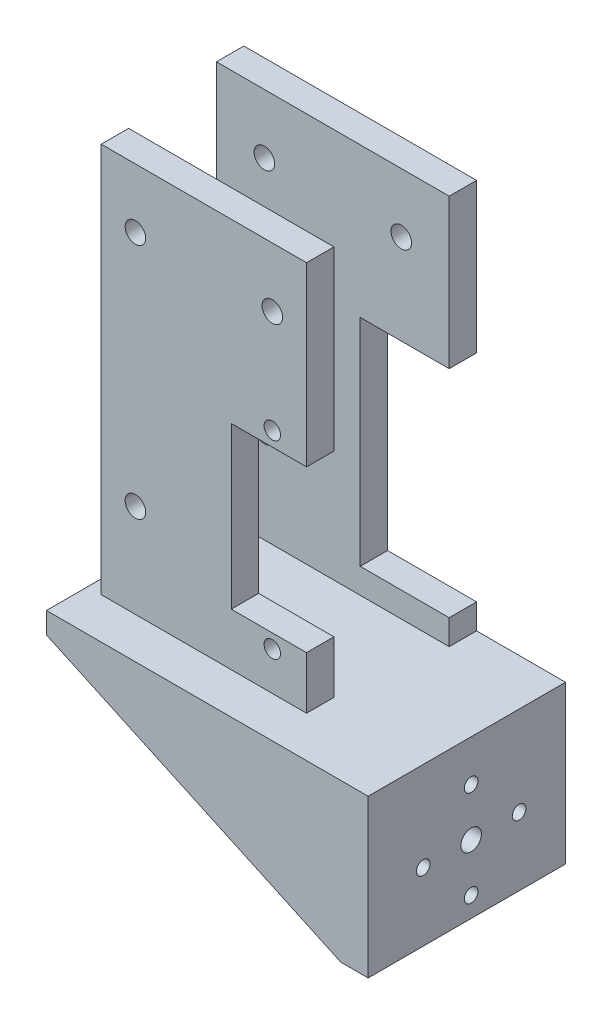
from build123d import *

# Parameters (mm, degrees)
SKETCH_1_R           = 1.5
SKETCH_1_R_2         = 1.2
EXTRUDE_1_DEPTH      = 4
SKETCH_2_W           = 19.899494937
SKETCH_2_H           = 19.899494937
SKETCH_2_R           = 1.5
EXTRUDE_2_DEPTH      = 4
EXTRUDE_3_DEPTH      = 15
EXTRUDE_3_DEPTH_BACK = 10
SKETCH_3_W           = 45
SKETCH_3_H           = 3.100505063
SKETCH_4_W           = 14.84
SKETCH_4_H           = 5
EXTRUDE_4_DEPTH      = 16
SKETCH_4_3_W         = 14.84
SKETCH_4_3_H         = 5
CUT_EXTRUDE_1_DEPTH  = 13
EXTRUDE_5_DEPTH      = 6
SKETCH_4_6_W         = 14.84
SKETCH_4_6_H         = 5
CUT_EXTRUDE_4_DEPTH  = 3
SKETCH_7_W           = 41
SKETCH_7_H           = 19.899494937
CUT_EXTRUDE_6_DEPTH  = 4
EXTRUDE_7_DEPTH      = 4
SKETCH_12_R          = 1.5
CUT_EXTRUDE_8_DEPTH  = 4
SKETCH_13_W          = 4
SKETCH_13_H          = 19.899494937
EXTRUDE_8_DEPTH      = 5.100505063
SKETCH_14_R          = 1.5
CUT_EXTRUDE_9_DEPTH  = 4
EXTRUDE_9_DEPTH      = 3.84
SKETCH_16_W          = 34
SKETCH_16_H          = 4
EXTRUDE_10_DEPTH     = 57
CUT_EXTRUDE_START    = -22.84
SKETCH_17_R          = 1.5
CUT_EXTRUDE_10_DEPTH = 22.84
SKETCH_18_W          = 2
SKETCH_18_H          = 3
EXTRUDE_11_DEPTH     = 3.100505063
SKETCH_19_W          = 24.84
SKETCH_19_H          = 3.100505063
EXTRUDE_12_DEPTH     = 2
EXTRUDE_13_DEPTH     = 4
SKETCH_21_W          = 13
SKETCH_21_H          = 31.5
CUT_EXTRUDE_11_DEPTH = 4
SKETCH_4_7_W         = 14.84
SKETCH_4_7_H         = 5
CUT_EXTRUDE_12_DEPTH = 16
SKETCH_22_W          = 2
SKETCH_22_H          = 3.100505063
EXTRUDE_14_DEPTH     = 1
SKETCH_23_R          = 1.5
EXTRUDE_15_DEPTH     = 4
SKETCH_24_R          = 1
CUT_EXTRUDE_13_DEPTH = 4


with BuildPart() as part:
    # 草图1 → 凸台-拉伸1 (new body)
    with BuildSketch(Plane.XY):
        Polygon((-15, -26), (-15, -54), (30, -54), (30, -31), (15, -31), (15, -26), (15, -23.333333333), (4, -23.333333333), (4, 0.166666667), (15, 0.166666667), (15, 26), (-15, 26), align=None)
        with Locations((-10, 17.333333333)):
            Circle(SKETCH_1_R, mode=Mode.SUBTRACT)
        with Locations((10, 17.333333333)):
            Circle(SKETCH_1_R, mode=Mode.SUBTRACT)
        with Locations((-10, -17.333333333)):
            Circle(SKETCH_1_R, mode=Mode.SUBTRACT)
        with Locations((10, 2.291666667)):
            Circle(SKETCH_1_R_2, mode=Mode.SUBTRACT)
        with Locations((10, -25.378333333)):
            Circle(SKETCH_1_R_2, mode=Mode.SUBTRACT)
    extrude(amount=EXTRUDE_1_DEPTH)

    # 草图2 → 凸台-拉伸2 (add)
    with BuildSketch(Plane(origin=(30, 0, 0), x_dir=(0, 0, -1), z_dir=(1, 0, 0))):
        with Locations((5.050252532, -44.050252531)):
            Rectangle(SKETCH_2_W, SKETCH_2_H)
        with Locations((0.100505063, -39.100505063)):
            Circle(SKETCH_2_R, mode=Mode.SUBTRACT)
        with Locations((10, -39.100505063)):
            Circle(SKETCH_2_R, mode=Mode.SUBTRACT)
        with Locations((0.100505063, -49)):
            Circle(SKETCH_2_R, mode=Mode.SUBTRACT)
        with Locations((10, -49)):
            Circle(SKETCH_2_R, mode=Mode.SUBTRACT)
    extrude(amount=-EXTRUDE_2_DEPTH)

    # 草图3 → 凸台-拉伸3 (add, two sides: drawn at the far end of the back side and taken through both)
    with BuildSketch(Plane(origin=(0, 0, 0), x_dir=(-1, 0, 0), z_dir=(0, 0, -1)).offset(-EXTRUDE_3_DEPTH_BACK)):
        with Locations((-7.5, -32.550252531)):
            Rectangle(SKETCH_3_W, SKETCH_3_H)
    extrude(amount=EXTRUDE_3_DEPTH + EXTRUDE_3_DEPTH_BACK)

    # 草图7 → 切除-拉伸6 (cut)
    with BuildSketch(Plane(origin=(0, 0, 0), x_dir=(-1, 0, 0), z_dir=(0, 0, -1))):
        with Locations((-5.5, -44.050252531)):
            Rectangle(SKETCH_7_W, SKETCH_7_H)
    extrude(amount=-CUT_EXTRUDE_6_DEPTH, mode=Mode.SUBTRACT)

    # 草图10 → 凸台-拉伸7 (add)
    with BuildSketch(Plane.XY.offset(10)):
        Polygon((26, -54), (-15, -34.100505063), (26, -34.100505063), align=None)
    extrude(amount=-EXTRUDE_7_DEPTH)

    # 草图12 → 切除-拉伸8 (cut)
    with BuildSketch(Plane(origin=(30, 0, 0), x_dir=(0, 0, -1), z_dir=(1, 0, 0))):
        with Locations(Location((5.050252532, -44.050252532, 0), (0, 0, 90))):
            Circle(SKETCH_12_R)
    extrude(amount=-CUT_EXTRUDE_8_DEPTH, mode=Mode.SUBTRACT)

    # 草图13 → 凸台-拉伸8 (add)
    with BuildSketch(Plane.XY.offset(4.899494937)):
        with Locations((28, -44.050252531)):
            Rectangle(SKETCH_13_W, SKETCH_13_H)
    extrude(amount=EXTRUDE_8_DEPTH)

    # 草图14 → 切除-拉伸9 (cut)
    with BuildSketch(Plane(origin=(30, 0, 0), x_dir=(0, 0, -1), z_dir=(1, 0, 0))):
        with Locations((0.100505063, -49)):
            Circle(SKETCH_14_R)
        with Locations((0.100505063, -39.100505063)):
            Circle(SKETCH_14_R)
    extrude(amount=-CUT_EXTRUDE_9_DEPTH, mode=Mode.SUBTRACT)

    # 草图15 → 凸台-拉伸9 (add)
    with BuildSketch(Plane(origin=(0, 0, -15), x_dir=(-1, 0, 0), z_dir=(0, 0, -1))):
        Polygon((-30, -31), (-30, -54), (-26, -54), (-26, -34.100505063), (15, -34.100505063), (15, -31), align=None)
    extrude(amount=EXTRUDE_9_DEPTH)



with BuildPart() as body_2:
    # 草图4 → 凸台-拉伸4 (new body)
    with BuildSketch(Plane.ZY.offset(15)):
        with Locations((-7.42, -28.5)):
            Rectangle(SKETCH_4_W, SKETCH_4_H)
    extrude(amount=-EXTRUDE_4_DEPTH)

    # 草图4<3> → 切除-拉伸1 (cut)
    with BuildSketch(Plane.ZY.offset(15)):
        with Locations((-7.42, -28.5)):
            Rectangle(SKETCH_4_3_W, SKETCH_4_3_H)
    extrude(amount=-CUT_EXTRUDE_1_DEPTH, mode=Mode.SUBTRACT)


with BuildPart() as body_3:
    # 草图4 → 凸台-拉伸5 (new body)
    with BuildSketch(Plane.ZY.offset(15)):
        with Locations((-7.42, -28.5)):
            Rectangle(SKETCH_4_W, SKETCH_4_H)
    extrude(amount=-EXTRUDE_5_DEPTH)

    # 草图4<6> → 切除-拉伸4 (cut)
    with BuildSketch(Plane.ZY.offset(15)):
        with Locations((-7.42, -28.5)):
            Rectangle(SKETCH_4_6_W, SKETCH_4_6_H)
    extrude(amount=-CUT_EXTRUDE_4_DEPTH, mode=Mode.SUBTRACT)


with BuildPart() as part_1:
    add(part.part)

    add(body_2.part)  # 凸台-拉伸10 merges body 2

    add(body_3.part)  # 凸台-拉伸10 merges body 3
    # 草图16 → 凸台-拉伸10 (add)
    with BuildSketch(Plane(origin=(0, -31, 0), x_dir=(1, 0, 0), z_dir=(0, 1, 0))):
        with Locations((0, 16.84)):
            Rectangle(SKETCH_16_W, SKETCH_16_H)
    extrude(amount=EXTRUDE_10_DEPTH)

    # 草图17 → 切除-拉伸10 (cut)
    with BuildSketch(Plane.XY.offset(4).offset(CUT_EXTRUDE_START)):
        with Locations((-10, -17.333333333)):
            Circle(SKETCH_17_R)
        with Locations((-10, 17.333333333)):
            Circle(SKETCH_17_R)
        with Locations((10, 17.333333333)):
            Circle(SKETCH_17_R)
    extrude(amount=CUT_EXTRUDE_10_DEPTH, mode=Mode.SUBTRACT)

    # 草图18 → 凸台-拉伸11 (add)
    with BuildSketch(Plane.XZ.offset(31)):
        with Locations((-16, -16.34)):
            Rectangle(SKETCH_18_W, SKETCH_18_H)
    extrude(amount=EXTRUDE_11_DEPTH)

    # 草图19 → 凸台-拉伸12 (add)
    with BuildSketch(Plane.ZY.offset(15)):
        with Locations((-2.42, -32.550252531)):
            Rectangle(SKETCH_19_W, SKETCH_19_H)
    extrude(amount=EXTRUDE_12_DEPTH)

    # 草图20 → 凸台-拉伸13 (add)
    with BuildSketch(Plane.XY.offset(10)):
        Polygon((26, -54), (-17, -34.100505063), (26, -34.100505063), align=None)
    extrude(amount=-EXTRUDE_13_DEPTH)

    # 草图21 → 切除-拉伸11 (cut)
    with BuildSketch(Plane.XY.offset(-14.84)):
        with Locations((10.5, -11.583333333)):
            Rectangle(SKETCH_21_W, SKETCH_21_H)
    extrude(amount=-CUT_EXTRUDE_11_DEPTH, mode=Mode.SUBTRACT)

    # 草图4<7> → 切除-拉伸12 (cut)
    with BuildSketch(Plane.ZY.offset(15)):
        with Locations((-7.42, -28.5)):
            Rectangle(SKETCH_4_7_W, SKETCH_4_7_H)
    extrude(amount=-CUT_EXTRUDE_12_DEPTH, mode=Mode.SUBTRACT)

    # 草图22 → 凸台-拉伸14 (add)
    with BuildSketch(Plane(origin=(0, 0, -17.84), x_dir=(-1, 0, 0), z_dir=(0, 0, -1))):
        with Locations((16, -32.550252531)):
            Rectangle(SKETCH_22_W, SKETCH_22_H)
    extrude(amount=EXTRUDE_14_DEPTH)

    # 草图23 → 凸台-拉伸15 (add)
    with BuildSketch(Plane(origin=(30, 0, 0), x_dir=(0, 0, -1), z_dir=(1, 0, 0))):
        with Locations((0.100505063, -49)):
            Circle(SKETCH_23_R)
        with Locations((0.100505063, -39.100505063)):
            Circle(SKETCH_23_R)
        with Locations((10, -49)):
            Circle(SKETCH_23_R)
        with Locations((10, -39.100505063)):
            Circle(SKETCH_23_R)
    extrude(amount=-EXTRUDE_15_DEPTH)

    # 草图24 → 切除-拉伸13 (cut)
    with BuildSketch(Plane(origin=(30, 0, 0), x_dir=(0, 0, -1), z_dir=(1, 0, 0))):
        with Locations(Location((-1.949747468, -44.050252532, 0), (0, 0, 90))):
            Circle(SKETCH_24_R)
        with Locations(Location((12.050252532, -44.050252532, 0), (0, 0, 90))):
            Circle(SKETCH_24_R)
        with Locations(Location((5.050252532, -37.050252532, 0), (0, 0, 90))):
            Circle(SKETCH_24_R)
        with Locations(Location((5.050252532, -51.050252532, 0), (0, 0, 90))):
            Circle(SKETCH_24_R)
    extrude(amount=-CUT_EXTRUDE_13_DEPTH, mode=Mode.SUBTRACT)


solid = part_1.part
